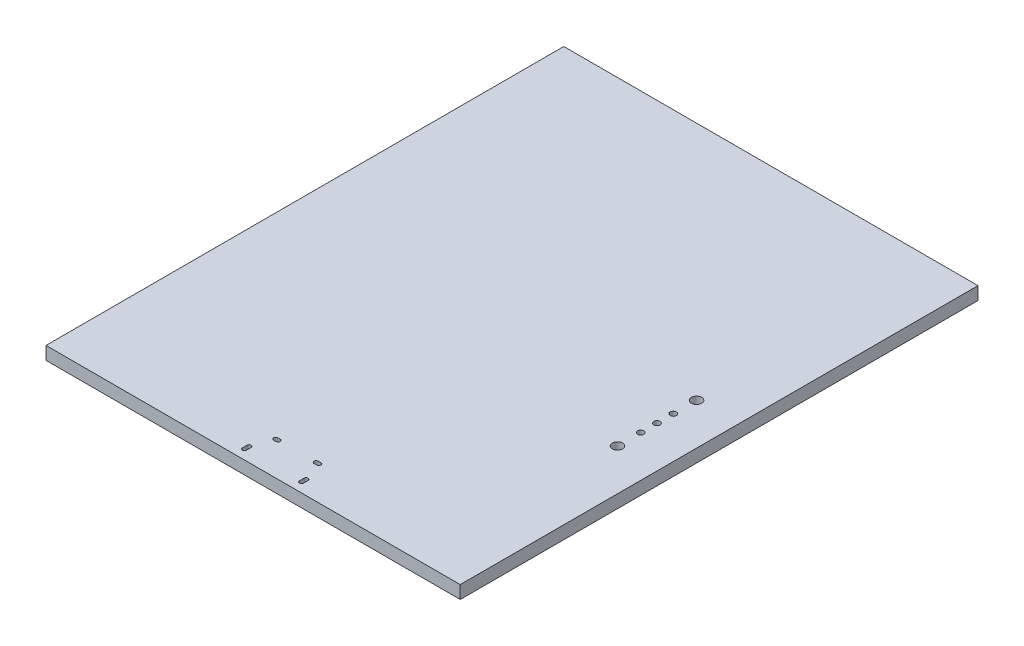
from build123d import *

# Parameters (mm, degrees)
SKETCH1_W           = 50.8
SKETCH1_H           = 63.5
BOSS_EXTRUDE1_DEPTH = 1.5875
SKETCH3_R           = 0.63175007
SKETCH3_R_2         = 0.381749935
CUT_EXTRUDE4_DEPTH  = 41.690817837


with BuildPart() as part:
    # Sketch1 → Boss-Extrude1 (new body)
    with BuildSketch(Plane(origin=(0, 0, 0), x_dir=(1, 0, 0), z_dir=(0, 1, 0))):
        Rectangle(SKETCH1_W, SKETCH1_H)
    extrude(amount=BOSS_EXTRUDE1_DEPTH)

    # Sketch3 → Cut-Extrude4 (cut, through all)
    with BuildSketch(Plane(origin=(0, 1.5875, 0), x_dir=(1, 0, 0), z_dir=(0, 1, 0))):
        with Locations(Location((20.319988808, -7.389796086, 0), (0, 0, 270))):
            Circle(SKETCH3_R)
        with Locations(Location((20.319988808, -4.539796706, 0), (0, 0, 270))):
            Circle(SKETCH3_R_2)
        with Locations(Location((20.319988808, -2.539795626, 0), (0, 0, 270))):
            Circle(SKETCH3_R_2)
        with Locations(Location((20.319988808, -0.539794546, 0), (0, 0, 270))):
            Circle(SKETCH3_R_2)
        with Locations(Location((20.319988808, 2.310204834, 0), (0, 0, 270))):
            Circle(SKETCH3_R)
        with BuildLine():
            Line((-1.380010972, -27.351995811), (-1.080011572, -27.351995811))
            ThreePointArc((-1.080011572, -27.351995811), (-0.830011437, -27.601995946), (-1.080011572, -27.851996081))
            Line((-1.080011572, -27.851996081), (-1.380010972, -27.851996081))
            ThreePointArc((-1.380010972, -27.851996081), (-1.630011107, -27.601995946), (-1.380010972, -27.351995811))
        make_face()
        with BuildLine():
            Line((3.569989288, -27.351995811), (3.919988588, -27.351995811))
            ThreePointArc((3.919988588, -27.351995811), (4.169988723, -27.601995946), (3.919988588, -27.851996081))
            Line((3.919988588, -27.851996081), (3.569989288, -27.851996081))
            ThreePointArc((3.569989288, -27.851996081), (3.319989153, -27.601995946), (3.569989288, -27.351995811))
        make_face()
        with BuildLine():
            Line((4.519989293, -30.026994906), (4.519989293, -30.576996346))
            ThreePointArc((4.519989293, -30.576996346), (4.769989428, -30.826996481), (5.019989563, -30.576996346))
            Line((5.019989563, -30.576996346), (5.019989563, -30.026994906))
            ThreePointArc((5.019989563, -30.026994906), (4.769989428, -29.776994771), (4.519989293, -30.026994906))
        make_face()
        with BuildLine():
            Line((-1.980011677, -30.026994906), (-1.980011677, -30.576996346))
            ThreePointArc((-1.980011677, -30.576996346), (-2.230011812, -30.826996481), (-2.480011947, -30.576996346))
            Line((-2.480011947, -30.576996346), (-2.480011947, -30.026994906))
            ThreePointArc((-2.480011947, -30.026994906), (-2.230011812, -29.776994771), (-1.980011677, -30.026994906))
        make_face()
    extrude(amount=-CUT_EXTRUDE4_DEPTH, mode=Mode.SUBTRACT)


solid = part.part
